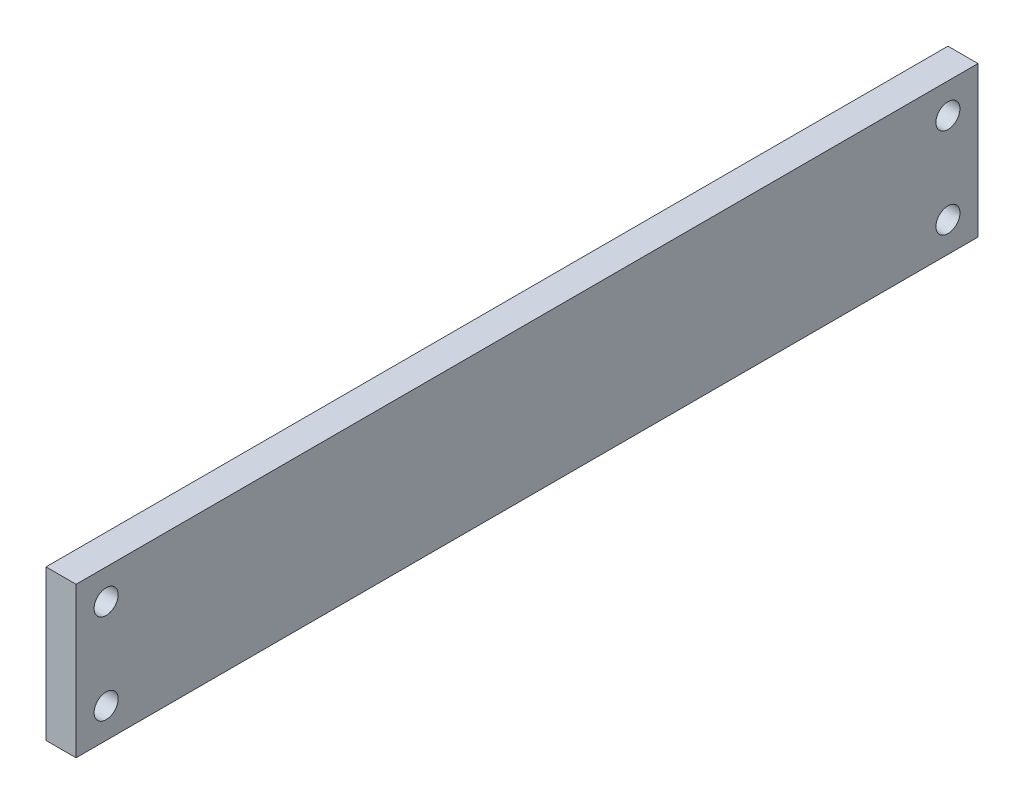
from build123d import *

# Parameters (mm, degrees)
SKETCH1_W           = 150
SKETCH1_H           = 25
BOSS_EXTRUDE1_DEPTH = 5
SKETCH2_R           = 2
CUT_EXTRUDE1_DEPTH  = 5


with BuildPart() as part:
    # Sketch1 → Boss-Extrude1 (new body)
    with BuildSketch(Plane(origin=(0, 0, 0), x_dir=(0, 0, -1), z_dir=(1, 0, 0))):
        Rectangle(SKETCH1_W, SKETCH1_H)
    extrude(amount=BOSS_EXTRUDE1_DEPTH)

    # Sketch2 → Cut-Extrude1 (cut)
    with BuildSketch(Plane(origin=(5, 0, 0), x_dir=(0, 0, -1), z_dir=(1, 0, 0))):
        with Locations((-70, 7.5)):
            Circle(SKETCH2_R)
        with Locations((-70, -7.5)):
            Circle(SKETCH2_R)
        with Locations((70, -7.5)):
            Circle(SKETCH2_R)
        with Locations((70, 7.5)):
            Circle(SKETCH2_R)
    extrude(amount=-CUT_EXTRUDE1_DEPTH, mode=Mode.SUBTRACT)


solid = part.part
